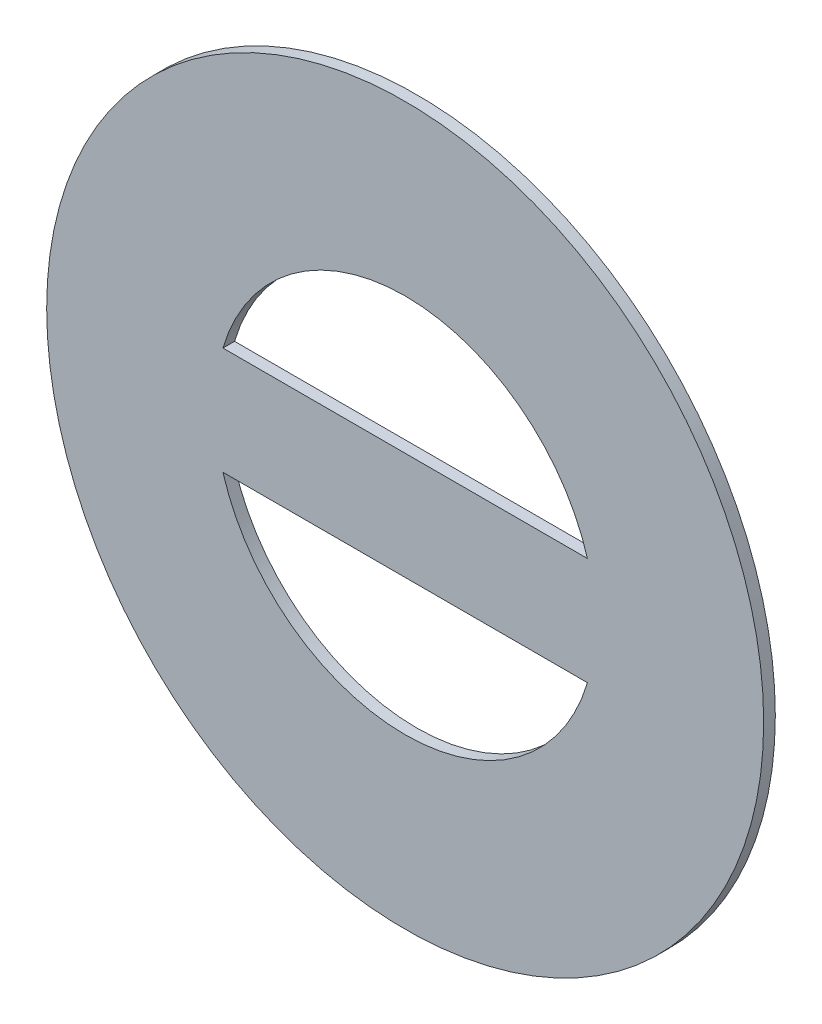
from build123d import *

# Parameters (mm, degrees)
SKETCH1_R           = 100
BOSS_EXTRUDE1_DEPTH = 3.25


with BuildPart() as part:
    # Sketch1 → Boss-Extrude1 (new body)
    with BuildSketch(Plane.XY):
        with Locations((4.870724861, -1.696758811)):
            Circle(SKETCH1_R)
        with BuildLine():
            ThreePointArc((55.70378497, -16.696758811), (4.870724861, -54.696758811), (-45.962335247, -16.696758811))
            Line((-45.962335247, -16.696758811), (55.70378497, -16.696758811))
        make_face(mode=Mode.SUBTRACT)
        with BuildLine():
            ThreePointArc((-45.962335247, 13.303241189), (4.870724861, 51.303241189), (55.70378497, 13.303241189))
            Line((55.70378497, 13.303241189), (-45.962335247, 13.303241189))
        make_face(mode=Mode.SUBTRACT)
    extrude(amount=BOSS_EXTRUDE1_DEPTH)


solid = part.part
